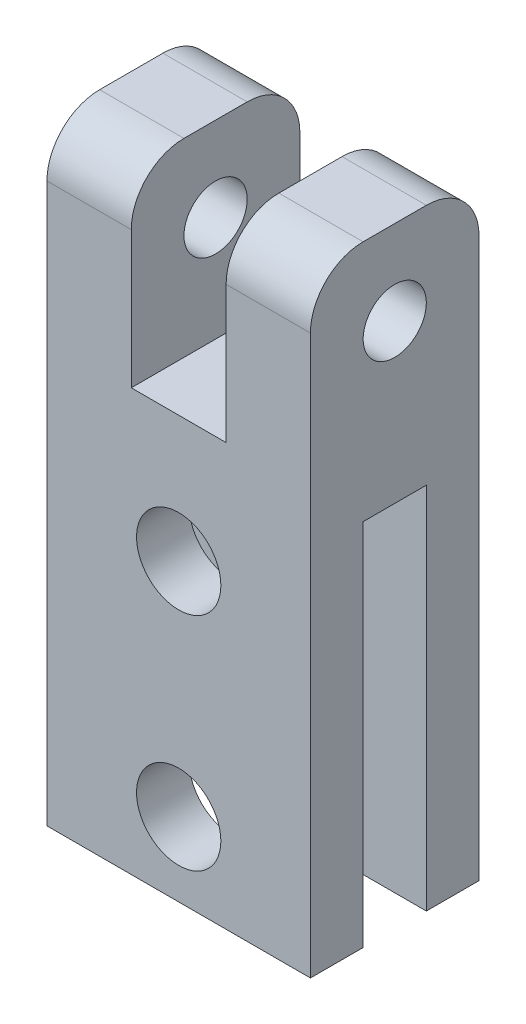
from build123d import *

# Parameters (mm, degrees)
IZIM1_R                     = 4
Y_KSEKLIK_EKSTR_ZYON1_DEPTH = 16
IZIM2_W                     = 25
IZIM2_H                     = 6
KES_EKSTR_ZYON1_DEPTH       = 35
KES_EKSTR_ZYON2_DEPTH       = 36
KES_EKSTR_ZYON2_DEPTH_BACK  = 20
IZIM3_R                     = 3
SKETCH2_W                   = 46.387108154
SKETCH2_H                   = 28.761742624
CUT_EXTRUDE1_DEPTH          = 2
FILLET1_R                   = 5


with BuildPart() as part:
    # Çizim1 → Yükseklik-Ekstrüzyon1 (new body)
    with BuildSketch(Plane.XY):
        Polygon((-12.5, 28), (-12.5, -7), (12.5, -7), (12.5, 28), (12.5, 53), (6, 53), (4.5, 53), (4.5, 33), (-4.5, 33), (-4.5, 53), (-6, 53), (-12.5, 53), align=None)
        with Locations((0, 21)):
            Circle(IZIM1_R, mode=Mode.SUBTRACT)
        Circle(IZIM1_R, mode=Mode.SUBTRACT)
    extrude(amount=Y_KSEKLIK_EKSTR_ZYON1_DEPTH)

    # Çizim2 → Kes-Ekstrüzyon1 (cut)
    with BuildSketch(Plane.XZ.offset(7)):
        with Locations((0, 8)):
            Rectangle(IZIM2_W, IZIM2_H)
    extrude(amount=-KES_EKSTR_ZYON1_DEPTH, mode=Mode.SUBTRACT)

    # Çizim3 → Kes-Ekstrüzyon2 (cut, two sides: drawn at the far end of the back side and taken through both)
    with BuildSketch(Plane.ZY.offset(-4.5).offset(-KES_EKSTR_ZYON2_DEPTH_BACK)):
        with Locations(Location((8, 43, 0), (0, 0, 180))):
            Circle(IZIM3_R)
    extrude(amount=KES_EKSTR_ZYON2_DEPTH + KES_EKSTR_ZYON2_DEPTH_BACK, mode=Mode.SUBTRACT)

    # Sketch2 → Cut-Extrude1 (cut)
    with BuildSketch(Plane(origin=(0, 53, 0), x_dir=(1, 0, 0), z_dir=(0, 1, 0))):
        with Locations((-0.016890664, -9.346912489)):
            Rectangle(SKETCH2_W, SKETCH2_H)
    extrude(amount=-CUT_EXTRUDE1_DEPTH, mode=Mode.SUBTRACT)

    # Fillet1
    fillet1_edges = [part.edges().sort_by_distance(p)[0] for p in [
        (8.5, 51, 16),
        (-8.5, 51, 16),
        (8.5, 51, 0),
        (-8.5, 51, 0),
    ]]
    fillet(fillet1_edges, radius=FILLET1_R)


solid = part.part
